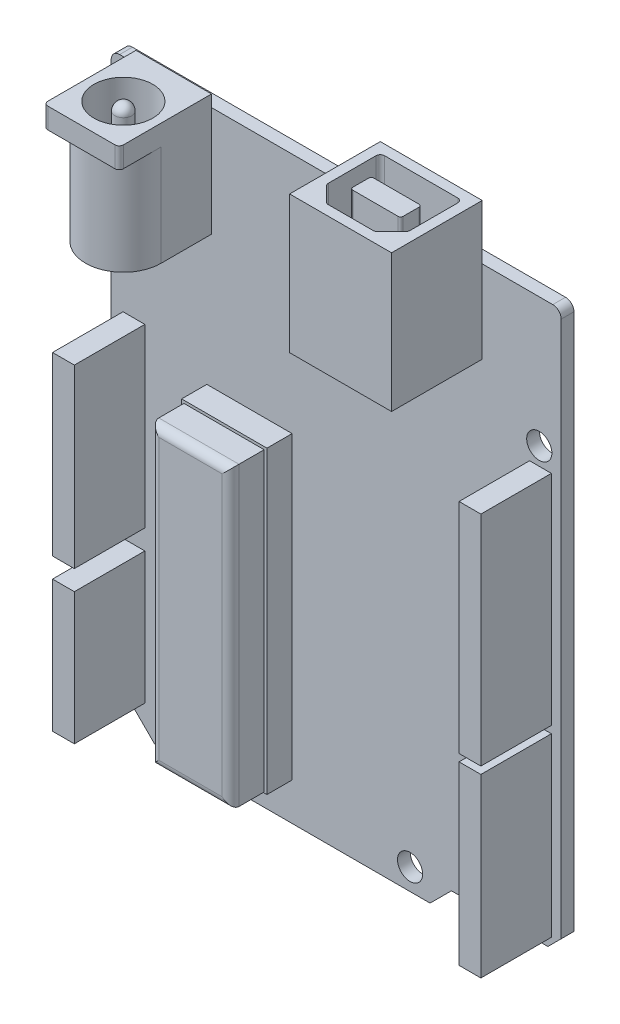
from build123d import *

# Parameters (mm, degrees)
ESBO_O2_R                = 1.5
RESSALTO_EXTRUS_O1_DEPTH = 1.52
ESBO_O3_W                = 9.002839431
ESBO_O3_H                = 14.464026403
RESSALTO_EXTRUS_O2_DEPTH = 11
ESBO_O4_W                = 2.6
ESBO_O4_H                = 21
ESBO_O4_H_2              = 26
ESBO_O4_H_3              = 15.7
RESSALTO_EXTRUS_O3_DEPTH = 8.4
CORTE_EXTRUS_O1_DEPTH    = 12
ESBO_O6_R                = 3.501419715
ESBO_O6_R_2              = 1
CORTE_EXTRUS_O2_DEPTH    = 12
FILETE1_R                = 1
FILETE2_R                = 0.5
ESBO_O7_W                = 12.143418905
ESBO_O7_H                = 16.377735741
RESSALTO_EXTRUS_O4_DEPTH = 10.8
CORTE_EXTRUS_O3_DEPTH    = 10
ESBO_O10_W               = 9.554785471
ESBO_O10_H               = 35.312042965
RESSALTO_EXTRUS_O5_DEPTH = 7
FILETE3_R                = 1
ESBO_O11_W               = 10.159902464
ESBO_O11_H               = 35.738148994
RESSALTO_EXTRUS_O6_DEPTH = 3


with BuildPart() as part:
    # Esboço2 → Ressalto-extrusão1 (new body)
    with BuildSketch(Plane.XY):
        with BuildLine():
            Line((26.8, -30.777402322), (25.217451408, -32.359950915))
            Line((25.217451408, -32.359950915), (13.7271729, -32.359950915))
            Line((13.7271729, -32.359950915), (11.181461411, -34.905662403))
            Line((11.181461411, -34.905662403), (-21.61825292, -34.905662403))
            Line((-21.61825292, -34.905662403), (-24.163964409, -32.359950915))
            Line((-24.163964409, -32.359950915), (-25.8, -32.359950915))
            ThreePointArc((-25.8, -32.359950915), (-26.507106781, -32.067057696), (-26.8, -31.359950915))
            Line((-26.8, -31.359950915), (-26.8, 33.15))
            ThreePointArc((-26.8, 33.15), (-26.507106781, 33.857106781), (-25.8, 34.15))
            Line((-25.8, 34.15), (25.8, 34.15))
            ThreePointArc((25.8, 34.15), (26.507106781, 33.857106781), (26.8, 33.15))
            Line((26.8, 33.15), (26.8, -30.777402322))
        make_face()
        with Locations((24.189792897, 18.770096718)):
            Circle(ESBO_O2_R, mode=Mode.SUBTRACT)
        with Locations((-24.163964409, 19.991194307)):
            Circle(ESBO_O2_R, mode=Mode.SUBTRACT)
        with Locations((-19.149057151, -32.359950915)):
            Circle(ESBO_O2_R, mode=Mode.SUBTRACT)
        with Locations((8.800152978, -32.359950915)):
            Circle(ESBO_O2_R, mode=Mode.SUBTRACT)
    extrude(amount=RESSALTO_EXTRUS_O1_DEPTH)

    # Esboço3 → Ressalto-extrusão2 (add)
    with BuildSketch(Plane.XY.offset(1.52)):
        with Locations((-19.353564393, 28.321014274)):
            Rectangle(ESBO_O3_W, ESBO_O3_H)
    extrude(amount=RESSALTO_EXTRUS_O2_DEPTH)

    # Esboço4 → Ressalto-extrusão3 (add)
    with BuildSketch(Plane.XY.offset(1.52)):
        with Locations((24.334460994, -20.701802403)):
            Rectangle(ESBO_O4_W, ESBO_O4_H)
        with Locations((24.334460994, 3.658197597)):
            Rectangle(ESBO_O4_W, ESBO_O4_H_2)
        with Locations((-24.092015344, -2.684387248)):
            Rectangle(ESBO_O4_W, ESBO_O4_H)
        with Locations((-24.092015344, -23.409860345)):
            Rectangle(ESBO_O4_W, ESBO_O4_H_3)
    extrude(amount=RESSALTO_EXTRUS_O3_DEPTH)

    # Esboço5 → Corte-extrusão1 (cut)
    with BuildSketch(Plane.XZ.offset(-21.089001072)):
        with BuildLine():
            Line((-14.852144677, 7.52), (-14.852144677, 12.52))
            Line((-14.852144677, 12.52), (-23.854984108, 12.52))
            Line((-23.854984108, 12.52), (-23.854984108, 7.52))
            ThreePointArc((-23.854984108, 7.52), (-19.353564393, 12.021419715), (-14.852144677, 7.52))
        make_face()
    extrude(amount=-CORTE_EXTRUS_O1_DEPTH, mode=Mode.SUBTRACT)

    # Esboço6 → Corte-extrusão2 (cut)
    with BuildSketch(Plane.XZ.offset(-35.553027475)):
        with Locations(Location((-19.353564393, 7.52, 0), (0, 0, 270))):
            Circle(ESBO_O6_R)
        with Locations(Location((-19.353564393, 7.52, 0), (0, 0, 270))):
            Circle(ESBO_O6_R_2, mode=Mode.SUBTRACT)
    extrude(amount=CORTE_EXTRUS_O2_DEPTH, mode=Mode.SUBTRACT)

    # Filete1
    filete1_edges = [part.edges().sort_by_distance(p)[0] for p in [
        (-19.353564393, 35.553027475, 8.52),
    ]]
    fillet(filete1_edges, radius=FILETE1_R)

    # Filete2
    filete2_edges = [part.edges().sort_by_distance(p)[0] for p in [
        (-14.852144677, 34.321014274, 12.52),
        (-23.854984108, 34.321014274, 12.52),
    ]]
    fillet(filete2_edges, radius=FILETE2_R)

    # Esboço7 → Ressalto-extrusão4 (add)
    with BuildSketch(Plane.XY.offset(1.52)):
        with Locations((11.324094847, 32.5040773)):
            Rectangle(ESBO_O7_W, ESBO_O7_H)
    extrude(amount=RESSALTO_EXTRUS_O4_DEPTH)

    # Esboço9 → Corte-extrusão3 (cut)
    with BuildSketch(Plane(origin=(0, 40.69294517, 0), x_dir=(1, 0, 0), z_dir=(0, 1, 0))):
        with BuildLine():
            Line((6.952385394, -2.72), (15.695804299, -2.72))
            ThreePointArc((15.695804299, -2.72), (16.04935769, -2.866446609), (16.195804299, -3.22))
            Line((16.195804299, -3.22), (16.195804299, -8.912893219))
            ThreePointArc((16.195804299, -8.912893219), (16.157744065, -9.104234935), (16.04935769, -9.266446609))
            Line((16.04935769, -9.266446609), (14.342250908, -10.973553391))
            ThreePointArc((14.342250908, -10.973553391), (14.180039234, -11.081939766), (13.988697518, -11.12))
            Line((13.988697518, -11.12), (8.659492175, -11.12))
            ThreePointArc((8.659492175, -11.12), (8.468150459, -11.081939766), (8.305938785, -10.973553391))
            Line((8.305938785, -10.973553391), (6.598832004, -9.266446609))
            ThreePointArc((6.598832004, -9.266446609), (6.490445628, -9.104234935), (6.452385394, -8.912893219))
            Line((6.452385394, -8.912893219), (6.452385394, -3.22))
            ThreePointArc((6.452385394, -3.22), (6.598832004, -2.866446609), (6.952385394, -2.72))
        make_face()
        with BuildLine():
            Line((14.024094847, -8.17), (8.624094847, -8.17))
            ThreePointArc((8.624094847, -8.17), (8.411962812, -8.082132034), (8.324094847, -7.87))
            Line((8.324094847, -7.87), (8.324094847, -5.97))
            ThreePointArc((8.324094847, -5.97), (8.411962812, -5.757867966), (8.624094847, -5.67))
            Line((8.624094847, -5.67), (14.024094847, -5.67))
            ThreePointArc((14.024094847, -5.67), (14.236226881, -5.757867966), (14.324094847, -5.97))
            Line((14.324094847, -5.97), (14.324094847, -7.87))
            ThreePointArc((14.324094847, -7.87), (14.236226881, -8.082132034), (14.024094847, -8.17))
        make_face(mode=Mode.SUBTRACT)
    extrude(amount=-CORTE_EXTRUS_O3_DEPTH, mode=Mode.SUBTRACT)

    # Esboço10 → Ressalto-extrusão5 (add)
    with BuildSketch(Plane.XY.offset(1.52)):
        with Locations((-10.358620196, -12.664154249)):
            Rectangle(ESBO_O10_W, ESBO_O10_H)
    extrude(amount=RESSALTO_EXTRUS_O5_DEPTH)

    # Filete3
    filete3_edges = [part.edges().sort_by_distance(p)[0] for p in [
        (-5.58122746, -12.664154249, 8.52),
        (-10.358620195, 4.991867234, 8.52),
        (-15.136012931, -12.664154249, 8.52),
        (-10.358620195, -30.320175731, 8.52),
    ]]
    fillet(filete3_edges, radius=FILETE3_R)

    # Esboço11 → Ressalto-extrusão6 (add)
    with BuildSketch(Plane.XY.offset(1.52)):
        with Locations((-10.332437347, -12.5521927)):
            Rectangle(ESBO_O11_W, ESBO_O11_H)
    extrude(amount=RESSALTO_EXTRUS_O6_DEPTH)


solid = part.part
